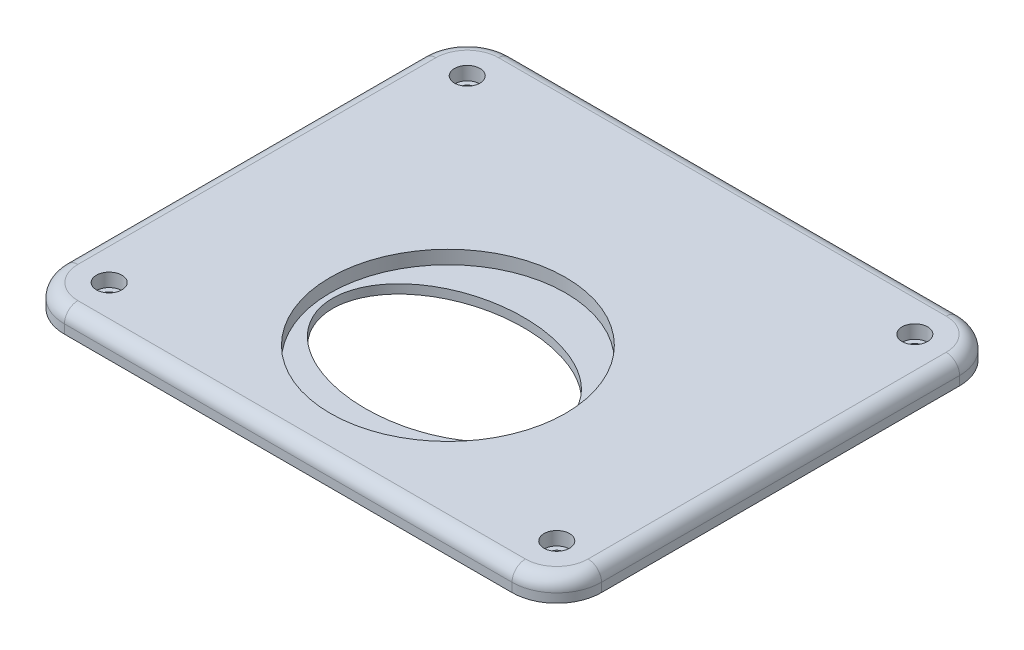
from build123d import *

# Parameters (mm, degrees)
SKETCH1_R           = 1.7
SKETCH1_RX          = 25
SKETCH1_RY          = 17.67766953
BOSS_EXTRUDE1_DEPTH = 2
BOSS_EXTRUDE2_START = 2
SKETCH1_3_R         = 2.85
SKETCH1_3_R_2       = 26.3
BOSS_EXTRUDE2_DEPTH = 3
FILLET1_R           = 3


with BuildPart() as part:
    # Sketch1 → Boss-Extrude1 (new body)
    with BuildSketch(Plane(origin=(0, 50, 0), x_dir=(1, 0, 0), z_dir=(0, 1, 0))):
        with BuildLine():
            Line((-50, -35.67766953), (50, -35.67766953))
            ThreePointArc((50, -35.67766953), (57.071067812, -32.748737342), (60, -25.67766953))
            Line((60, -25.67766953), (60, 54.32233047))
            ThreePointArc((60, 54.32233047), (57.071067812, 61.393398282), (50, 64.32233047))
            Line((50, 64.32233047), (-50, 64.32233047))
            ThreePointArc((-50, 64.32233047), (-57.071067812, 61.393398282), (-60, 54.32233047))
            Line((-60, 54.32233047), (-60, -25.67766953))
            ThreePointArc((-60, -25.67766953), (-57.071067812, -32.748737342), (-50, -35.67766953))
        make_face()
        with Locations(Location((-50, -25.67766953, 0), (0, 0, 270))):
            Circle(SKETCH1_R, mode=Mode.SUBTRACT)
        with Locations(Location((50, -25.67766953, 0), (0, 0, 270))):
            Circle(SKETCH1_R, mode=Mode.SUBTRACT)
        with Locations(Location((50, 54.32233047, 0), (0, 0, 270))):
            Circle(SKETCH1_R, mode=Mode.SUBTRACT)
        with Locations(Location((-50, 54.32233047, 0), (0, 0, 270))):
            Circle(SKETCH1_R, mode=Mode.SUBTRACT)
        with Locations(Location((0, -0.777817459), (0, 0, -180))):
            Ellipse(SKETCH1_RX, SKETCH1_RY, mode=Mode.SUBTRACT)
    extrude(amount=BOSS_EXTRUDE1_DEPTH)

    # Sketch1<3> → Boss-Extrude2 (add)
    with BuildSketch(Plane(origin=(0, 50, 0), x_dir=(1, 0, 0), z_dir=(0, 1, 0)).offset(BOSS_EXTRUDE2_START)):
        with BuildLine():
            Line((-50, -35.67766953), (50, -35.67766953))
            ThreePointArc((50, -35.67766953), (57.071067812, -32.748737342), (60, -25.67766953))
            Line((60, -25.67766953), (60, 54.32233047))
            ThreePointArc((60, 54.32233047), (57.071067812, 61.393398282), (50, 64.32233047))
            Line((50, 64.32233047), (-50, 64.32233047))
            ThreePointArc((-50, 64.32233047), (-57.071067812, 61.393398282), (-60, 54.32233047))
            Line((-60, 54.32233047), (-60, -25.67766953))
            ThreePointArc((-60, -25.67766953), (-57.071067812, -32.748737342), (-50, -35.67766953))
        make_face()
        with Locations(Location((-50, 54.32233047, 0), (0, 0, 270))):
            Circle(SKETCH1_3_R, mode=Mode.SUBTRACT)
        with Locations(Location((-50, -25.67766953, 0), (0, 0, 270))):
            Circle(SKETCH1_3_R, mode=Mode.SUBTRACT)
        with Locations(Location((50, 54.32233047, 0), (0, 0, 270))):
            Circle(SKETCH1_3_R, mode=Mode.SUBTRACT)
        with Locations(Location((50, -25.67766953, 0), (0, 0, 270))):
            Circle(SKETCH1_3_R, mode=Mode.SUBTRACT)
        with Locations(Location((0, 0, 0), (0, 0, 270))):
            Circle(SKETCH1_3_R_2, mode=Mode.SUBTRACT)
    extrude(amount=BOSS_EXTRUDE2_DEPTH)

    # Fillet1
    fillet1_edges = [part.edges().sort_by_distance(p)[0] for p in [
        (57.071067812, 55, 32.748737342),
        (57.071067812, 55, -61.393398282),
        (-57.071067812, 55, -61.393398282),
        (-57.071067812, 55, 32.748737342),
        (60, 55, -14.32233047),
        (0, 55, -64.32233047),
        (-60, 55, -14.32233047),
        (0, 55, 35.67766953),
    ]]
    fillet(fillet1_edges, radius=FILLET1_R)


solid = part.part
